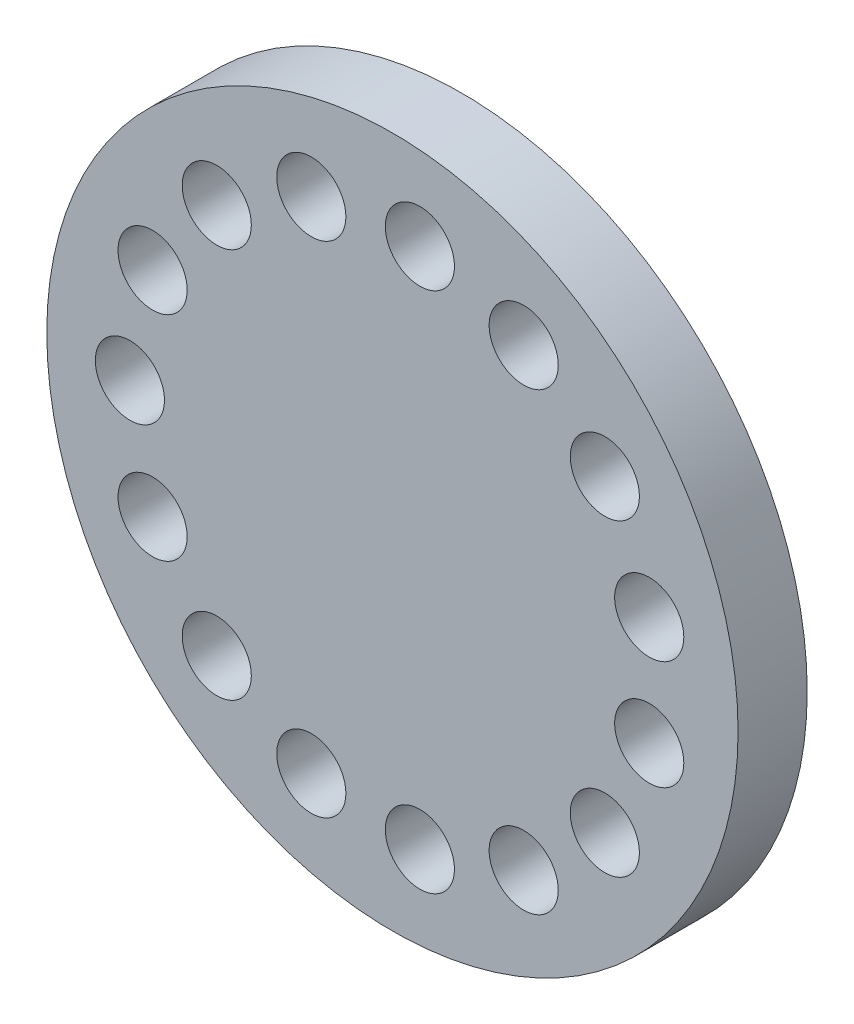
from build123d import *

# Parameters (mm, degrees)
CROQUIS1_R              = 50
CROQUIS1_R_2            = 5
SALIENTE_EXTRUIR1_DEPTH = 10


with BuildPart() as part:
    # Croquis1 → Saliente-Extruir1 (new body)
    with BuildSketch(Plane.XY):
        Circle(CROQUIS1_R)
        with Locations((-37.977099237, 0)):
            Circle(CROQUIS1_R_2, mode=Mode.SUBTRACT)
        with Locations((-34.693806502, 15.446677857)):
            Circle(CROQUIS1_R_2, mode=Mode.SUBTRACT)
        with Locations((-25.41163944, 28.222484784)):
            Circle(CROQUIS1_R_2, mode=Mode.SUBTRACT)
        with Locations((-11.735569061, 36.118367699)):
            Circle(CROQUIS1_R_2, mode=Mode.SUBTRACT)
        with Locations((3.969687823, 37.769056713)):
            Circle(CROQUIS1_R_2, mode=Mode.SUBTRACT)
        with Locations((18.988549618, 32.889132701)):
            Circle(CROQUIS1_R_2, mode=Mode.SUBTRACT)
        with Locations((30.72411868, 22.322378856)):
            Circle(CROQUIS1_R_2, mode=Mode.SUBTRACT)
        with Locations((37.147208501, 7.895882915)):
            Circle(CROQUIS1_R_2, mode=Mode.SUBTRACT)
        with Locations((37.147208501, -7.895882915)):
            Circle(CROQUIS1_R_2, mode=Mode.SUBTRACT)
        with Locations((30.72411868, -22.322378856)):
            Circle(CROQUIS1_R_2, mode=Mode.SUBTRACT)
        with Locations((18.988549618, -32.889132701)):
            Circle(CROQUIS1_R_2, mode=Mode.SUBTRACT)
        with Locations((3.969687823, -37.769056713)):
            Circle(CROQUIS1_R_2, mode=Mode.SUBTRACT)
        with Locations((-11.735569061, -36.118367699)):
            Circle(CROQUIS1_R_2, mode=Mode.SUBTRACT)
        with Locations((-25.41163944, -28.222484784)):
            Circle(CROQUIS1_R_2, mode=Mode.SUBTRACT)
        with Locations((-34.693806502, -15.446677857)):
            Circle(CROQUIS1_R_2, mode=Mode.SUBTRACT)
    extrude(amount=SALIENTE_EXTRUIR1_DEPTH)


solid = part.part
